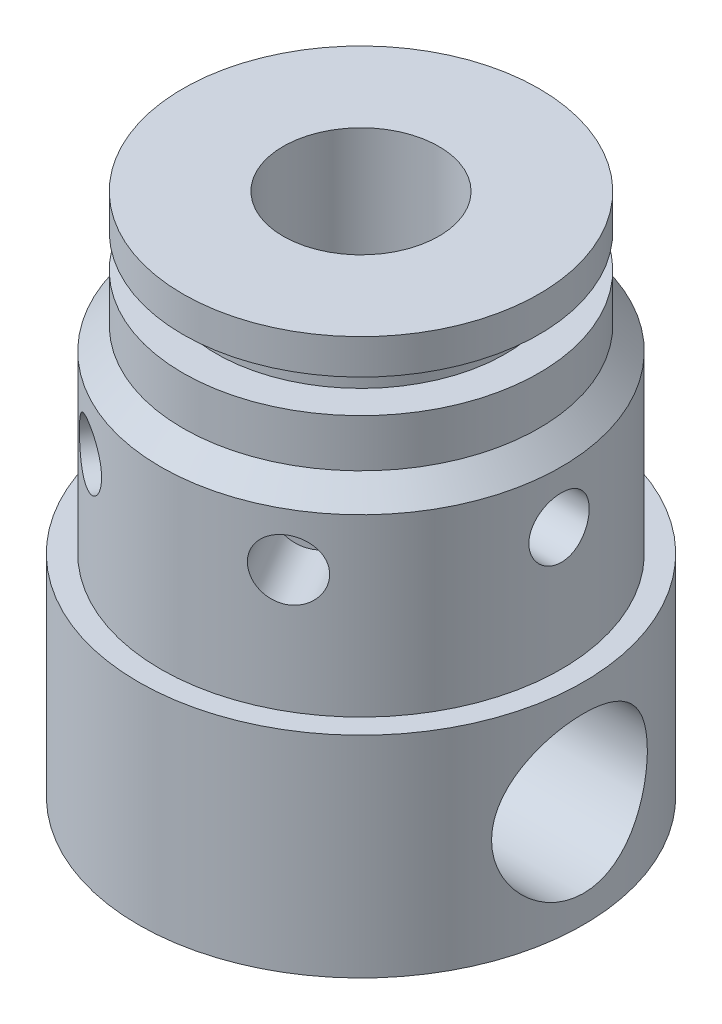
from build123d import *

# Parameters (mm, degrees)
CUT_EXTRUDE1_DEPTH      = 30.212509527
CUT_EXTRUDE1_DEPTH_BACK = 30.212509527
SKETCH2_R               = 5.55625
SKETCH4_R               = 2.15
CUT_EXTRUDE3_DEPTH      = 5
CIRPATTERN1_COUNT       = 6
CUT_EXTRUDE4_REACH      = 45.605
CUT_EXTRUDE4_END_RADIUS = 5.55625
SKETCH6_R               = 5.555


with BuildPart() as part:
    # Sketch1 → Revolve1 (revolve)
    with BuildSketch(Plane.XY, mode=Mode.PRIVATE) as revolve1_sk:
        Polygon((0, -18.690625), (15.875, -18.690625), (15.875, -3.690625), (14.29, -3.690625), (14.29, 8.809375), (12.7, 10.399375), (12.7, 13.809375), (10.31875, 13.809375), (10.31875, 16.190625), (12.7, 16.190625), (12.7, 18.690625), (0, 18.690625), align=None)
    revolve(revolve1_sk.sketch.rotate(Axis((0, -8.095014715, 0), (0, 1, 0)), 90), axis=Axis((0, -8.095014715, 0), (0, 1, 0)))

    # Sketch2 → Cut-Extrude1 (cut, two sides: drawn at the far end of the back side and taken through both)
    with BuildSketch(Plane(origin=(0, 0, 0), x_dir=(0, 0, -1), z_dir=(1, 0, 0)).offset(-CUT_EXTRUDE1_DEPTH_BACK)):
        with Locations((0, -11.190625)):
            Circle(SKETCH2_R)
    extrude(amount=CUT_EXTRUDE1_DEPTH + CUT_EXTRUDE1_DEPTH_BACK, mode=Mode.SUBTRACT)

    # Sketch4 → Cut-Extrude3 (cut)
    with BuildSketch(Plane(origin=(14.29, 0, 0), x_dir=(0, 0, -1), z_dir=(1, 0, 0))):
        with Locations((0, 5.059375)):
            Circle(SKETCH4_R)
    cut_extrude3 = extrude(amount=-CUT_EXTRUDE3_DEPTH, mode=Mode.SUBTRACT)

    # CirPattern1: Cut-Extrude3 ×6 about axis
    cirpattern1_axis = Axis((0, 0, 0), (0, 1, 0))
    for i in range(1, CIRPATTERN1_COUNT):
        add(cut_extrude3.rotate(cirpattern1_axis, i * 360 / CIRPATTERN1_COUNT), mode=Mode.SUBTRACT)

    # Cut-Extrude4: up to this cylinder (the profile starts outside it)
    cut_extrude4_end = Plane(origin=(0, -11.190625, 0), z_dir=(1, 0, 0)) * Cylinder(CUT_EXTRUDE4_END_RADIUS, 103.3225, mode=Mode.PRIVATE)
    # Sketch6 → Cut-Extrude4 (cut, up to the surface)
    with BuildSketch(Plane(origin=(0, 18.690625, 0), x_dir=(1, 0, 0), z_dir=(0, 1, 0)), mode=Mode.PRIVATE) as cut_extrude4_sk1:
        with Locations(Location((0, 0, 0), (0, 0, 270))):
            Circle(SKETCH6_R)
    cut_extrude4_tool1 = extrude(cut_extrude4_sk1.sketch, amount=-CUT_EXTRUDE4_REACH, mode=Mode.PRIVATE) - cut_extrude4_end
    add(cut_extrude4_tool1.solids().sort_by_distance((0, 18.690625, 0))[0], mode=Mode.SUBTRACT)


solid = part.part
